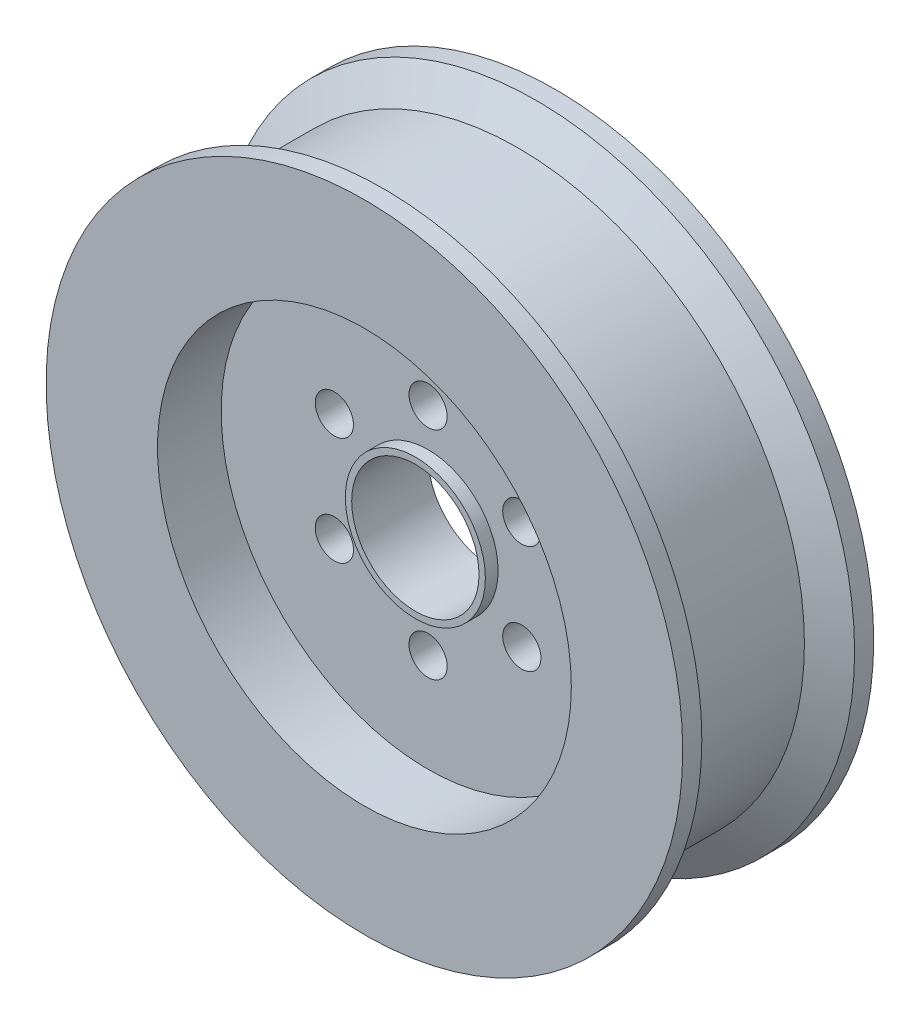
from build123d import *

# Parameters (mm, degrees)
SKETCH1_R                = 50
SKETCH1_R_2              = 10
BOSS_EXTRUDE1_DEPTH      = 15
SKETCH2_R                = 32.5
CUT_EXTRUDE2_DEPTH       = 10
SKETCH3_R                = 3
CUT_EXTRUDE8_DEPTH       = 10
CIRPATTERN1_COUNT        = 6
BOSS_EXTRUDE3_DEPTH      = 2
BOSS_EXTRUDE3_DEPTH_BACK = 7
SKETCH4_R                = 11
SKETCH4_R_2              = 10


with BuildPart() as part:
    # Sketch1 → Boss-Extrude1 (new, symmetric)
    with BuildSketch(Plane.XY):
        Circle(SKETCH1_R)
        Circle(SKETCH1_R_2, mode=Mode.SUBTRACT)
    extrude(amount=BOSS_EXTRUDE1_DEPTH, both=True)

    # Sketch2 → Cut-Extrude2 (cut)
    with BuildSketch(Plane.XY.offset(15)):
        Circle(SKETCH2_R)
    cut_extrude2 = extrude(amount=-CUT_EXTRUDE2_DEPTH, mode=Mode.SUBTRACT)

    # Mirror2: Cut-Extrude2 across plane
    add(cut_extrude2.mirror(Plane.XY), mode=Mode.SUBTRACT)

    # Sketch3 → Cut-Extrude8 (cut)
    with BuildSketch(Plane.XY.offset(5)):
        with Locations((0, 17)):
            Circle(SKETCH3_R)
    cut_extrude8 = extrude(amount=-CUT_EXTRUDE8_DEPTH, mode=Mode.SUBTRACT)

    # CirPattern1: Cut-Extrude8 ×6 about axis
    cirpattern1_axis = Axis((0, 0, 0), (0, 0, 1))
    for i in range(1, CIRPATTERN1_COUNT):
        add(cut_extrude8.rotate(cirpattern1_axis, i * 360 / CIRPATTERN1_COUNT), mode=Mode.SUBTRACT)

    # Sketch4 → Boss-Extrude3 (add, two sides: drawn at the far end of the back side and taken through both)
    with BuildSketch(Plane.XY.offset(5).offset(-BOSS_EXTRUDE3_DEPTH_BACK)):
        Circle(SKETCH4_R)
        with Locations(Location((0, 0, 0), (0, 0, 180))):
            Circle(SKETCH4_R_2, mode=Mode.SUBTRACT)
    extrude(amount=BOSS_EXTRUDE3_DEPTH + BOSS_EXTRUDE3_DEPTH_BACK)

    # Sketch5 → Cut-Revolve2 (revolve, cut)
    with BuildSketch(Plane(origin=(0, 0, 0), x_dir=(1, 0, 0), z_dir=(0, 1, 0))):
        Polygon((50, 12), (45, 9.113248654), (45, -9.113248654), (50, -12), align=None)
    revolve(axis=Axis((0, 0, 0), (0, 0, -1)), mode=Mode.SUBTRACT)


solid = part.part
